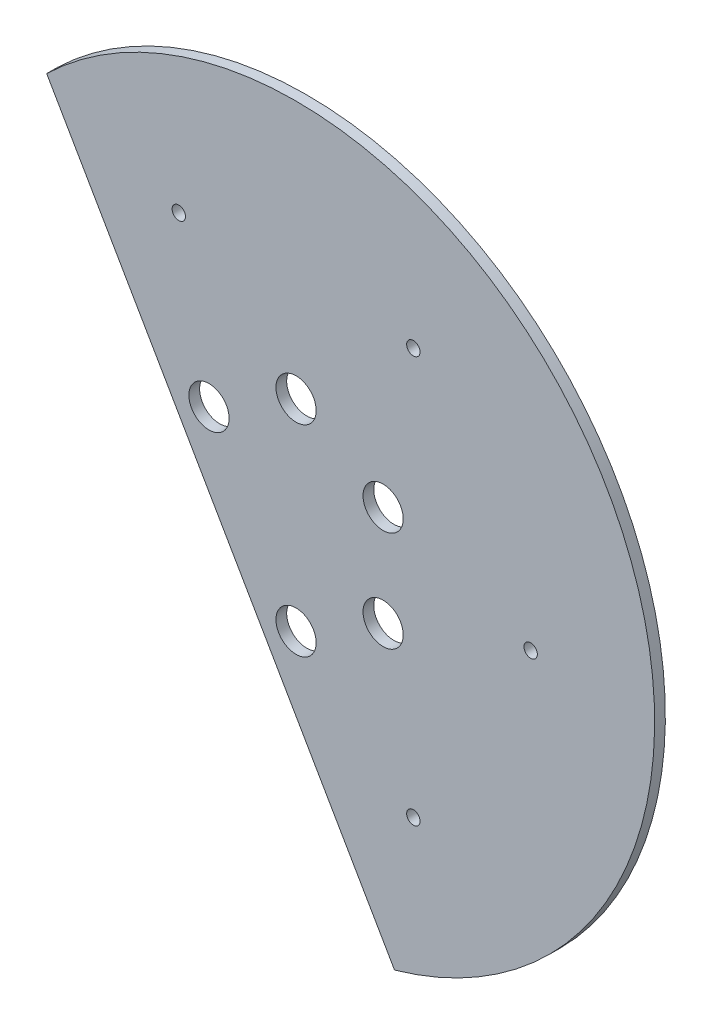
from build123d import *

# Parameters (mm, degrees)
ESQUISSE1_R             = 53.5
ESQUISSE1_R_2           = 1
ESQUISSE1_R_3           = 3
BOSS_EXTRU_1_DEPTH      = 1.6
ENL_V_MAT_EXTRU_1_DEPTH = 76.677341391


with BuildPart() as part:
    # Esquisse1 → Boss.-Extru.1 (new body)
    with BuildSketch(Plane.XY):
        Circle(ESQUISSE1_R)
        with Locations((35, 0)):
            Circle(ESQUISSE1_R_2, mode=Mode.SUBTRACT)
        with Locations((17.5, -30.310889132)):
            Circle(ESQUISSE1_R_2, mode=Mode.SUBTRACT)
        with Locations((-17.5, -30.310889132)):
            Circle(ESQUISSE1_R_2, mode=Mode.SUBTRACT)
        with Locations((-35, 0)):
            Circle(ESQUISSE1_R_2, mode=Mode.SUBTRACT)
        with Locations((-17.5, 30.310889132)):
            Circle(ESQUISSE1_R_2, mode=Mode.SUBTRACT)
        with Locations((17.5, 30.310889132)):
            Circle(ESQUISSE1_R_2, mode=Mode.SUBTRACT)
        with Locations((0, -15)):
            Circle(ESQUISSE1_R_3, mode=Mode.SUBTRACT)
        with Locations((12.990381057, -7.5)):
            Circle(ESQUISSE1_R_3, mode=Mode.SUBTRACT)
        with Locations((12.990381057, 7.5)):
            Circle(ESQUISSE1_R_3, mode=Mode.SUBTRACT)
        with Locations((0, 15)):
            Circle(ESQUISSE1_R_3, mode=Mode.SUBTRACT)
        with Locations((-12.990381057, 7.5)):
            Circle(ESQUISSE1_R_3, mode=Mode.SUBTRACT)
    extrude(amount=BOSS_EXTRU_1_DEPTH)

    # Esquisse2 → Enlèv. mat.-Extru.1 (cut, through all)
    with BuildSketch(Plane.XY.offset(1.6)):
        with BuildLine():
            Line((-37.206596087, 38.4437148), (14.689935589, -51.4437148))
            ThreePointArc((14.689935589, -51.4437148), (-46.332359102, -26.75), (-37.206596087, 38.4437148))
        make_face()
    extrude(amount=-ENL_V_MAT_EXTRU_1_DEPTH, mode=Mode.SUBTRACT)


solid = part.part
